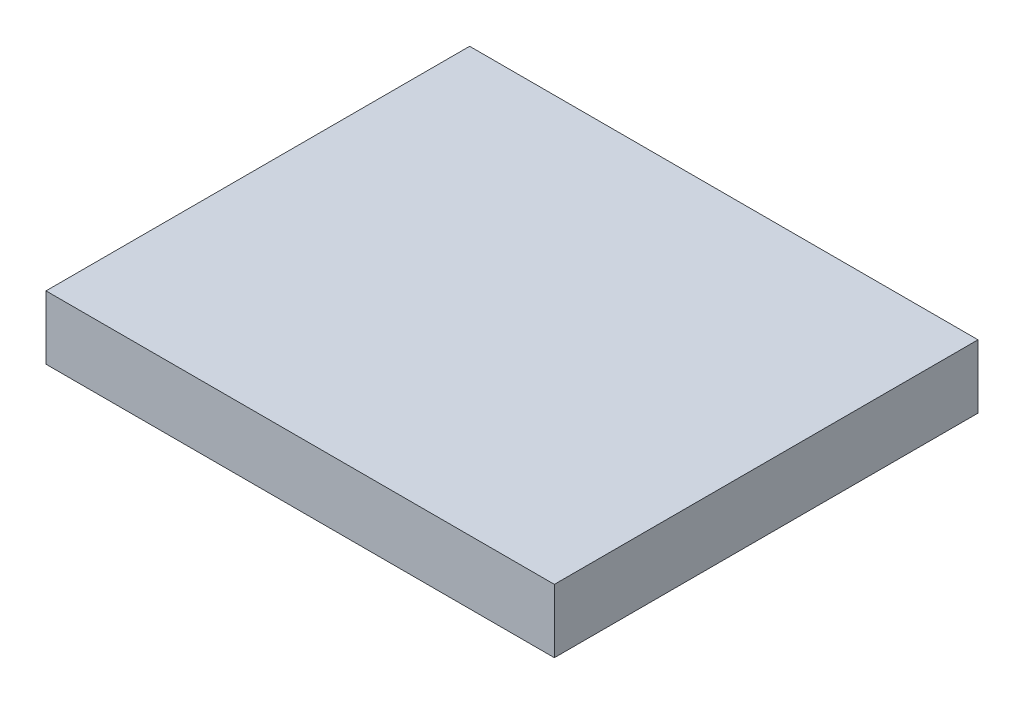
from build123d import *

# Parameters (mm, degrees)
SKETCH1_W           = 1219.2
SKETCH1_H           = 1016
BOSS_EXTRUDE1_DEPTH = 152.4


with BuildPart() as part:
    # Sketch1 → Boss-Extrude1 (new body)
    with BuildSketch(Plane(origin=(0, 0, 0), x_dir=(1, 0, 0), z_dir=(0, 1, 0))):
        Rectangle(SKETCH1_W, SKETCH1_H)
    extrude(amount=BOSS_EXTRUDE1_DEPTH)


solid = part.part
